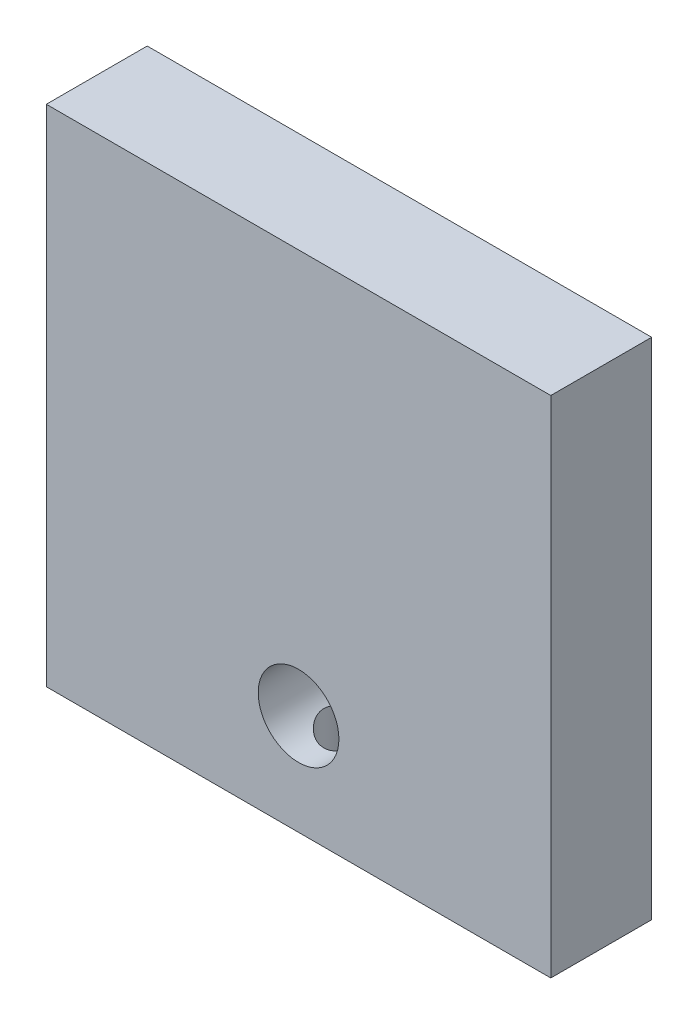
from build123d import *

# Parameters (mm, degrees)
SKETCH_1_W          = 50
SKETCH_1_H          = 50
EXTRUDE_1_DEPTH     = 10
SKETCH_2_R          = 4
CUT_EXTRUDE_1_DEPTH = 10
SKETCH_3_R          = 2.5
CUT_EXTRUDE_2_DEPTH = 10


with BuildPart() as part:
    # Эскиз1 → Бобышка-Вытянуть1 (new body)
    with BuildSketch(Plane.XY):
        with Locations((25, 25)):
            Rectangle(SKETCH_1_W, SKETCH_1_H)
    extrude(amount=EXTRUDE_1_DEPTH)

    # Эскиз2 → Вырез-Вытянуть1 (cut)
    with BuildSketch(Plane.XY.offset(10)):
        with Locations((25, 10)):
            Circle(SKETCH_2_R)
    extrude(amount=-CUT_EXTRUDE_1_DEPTH, mode=Mode.SUBTRACT)

    # Эскиз3 → Вырез-Вытянуть2 (cut)
    with BuildSketch(Plane.XZ):
        with Locations(Location((25, 5, 0), (0, 0, 270))):
            Circle(SKETCH_3_R)
    extrude(amount=-CUT_EXTRUDE_2_DEPTH, mode=Mode.SUBTRACT)


solid = part.part
